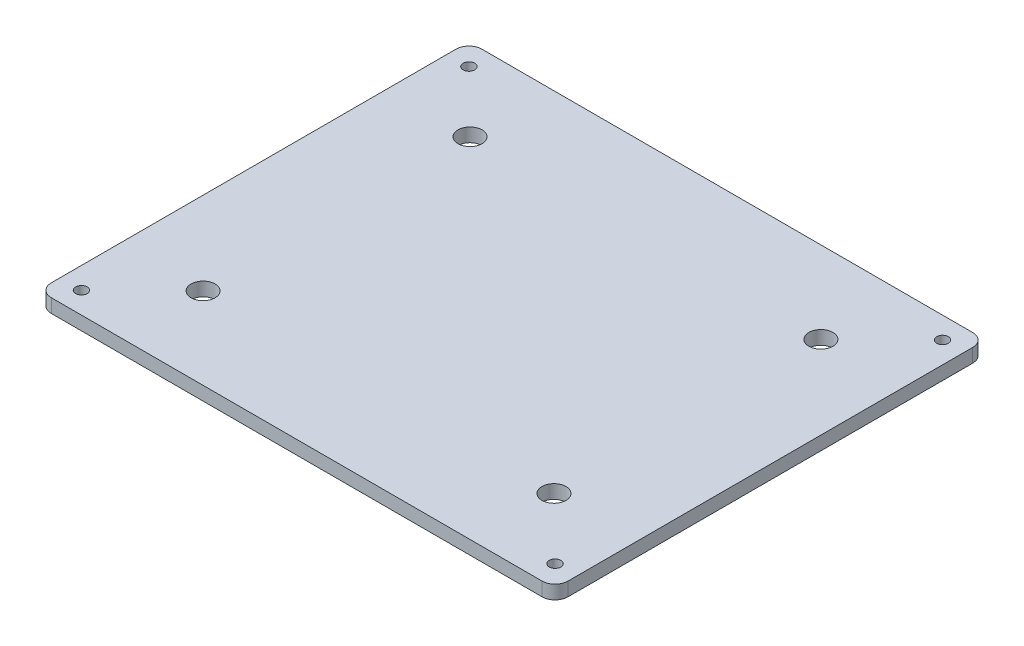
from build123d import *

# Parameters (mm, degrees)
SKETCH1_W              = 120
SKETCH1_H              = 100
BOSS_EXTRUDE1_DEPTH    = 3.175
SKETCH2_R              = 2.794
CUT_EXTRUDE1_DEPTH     = 79.167004708
M2_5_CLEARANCE_HOLE1_D = 2.7
FILLET1_R              = 3


with BuildPart() as part:
    # Sketch1 → Boss-Extrude1 (new body)
    with BuildSketch(Plane(origin=(0, 0, 0), x_dir=(1, 0, 0), z_dir=(0, 1, 0))):
        Rectangle(SKETCH1_W, SKETCH1_H)
    extrude(amount=BOSS_EXTRUDE1_DEPTH)

    # Sketch2 → Cut-Extrude1 (cut, through all)
    with BuildSketch(Plane(origin=(0, 3.175, 0), x_dir=(1, 0, 0), z_dir=(0, 1, 0))):
        with Locations(Location((-40.75, 31, 0), (0, 0, 270))):
            Circle(SKETCH2_R)
        with Locations(Location((-40.75, -31, 0), (0, 0, 270))):
            Circle(SKETCH2_R)
        with Locations(Location((40.75, -31, 0), (0, 0, 270))):
            Circle(SKETCH2_R)
        with Locations(Location((40.75, 31, 0), (0, 0, 270))):
            Circle(SKETCH2_R)
    extrude(amount=-CUT_EXTRUDE1_DEPTH, mode=Mode.SUBTRACT)

    # M2.5 Clearance Hole1 (through all)
    with Locations(Plane(origin=(0, 3.175, 0), x_dir=(1, 0, 0), z_dir=(0, 1, 0))):
        with Locations((-55, 45), (55, 45), (-55, -45), (55, -45)):
            Hole(M2_5_CLEARANCE_HOLE1_D / 2)

    # Fillet1
    fillet1_edges = [part.edges().sort_by_distance(p)[0] for p in [
        (-60, 1.5875, -50),
        (60, 1.5875, -50),
        (60, 1.5875, 50),
        (-60, 1.5875, 50),
    ]]
    fillet(fillet1_edges, radius=FILLET1_R)


solid = part.part
